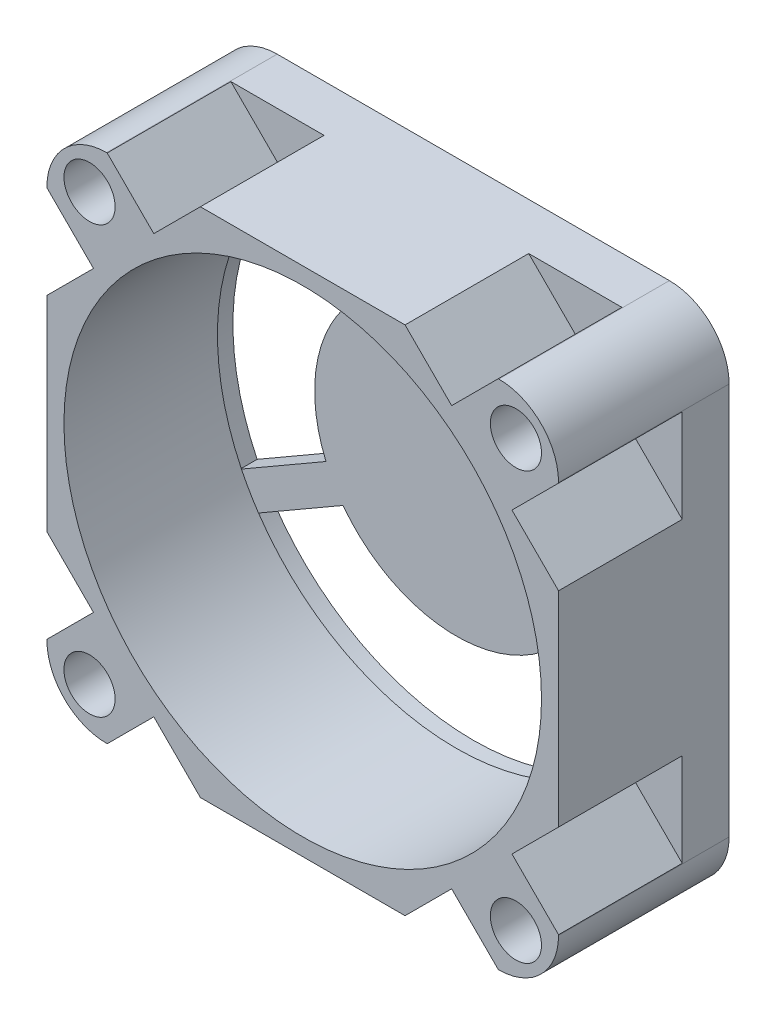
from build123d import *

# Parameters (mm, degrees)
SKETCH1_W             = 30
SKETCH1_H             = 30
BOSS_EXTRUDE1_DEPTH   = 10
SKETCH2_R             = 14
CUT_EXTRUDE1_DEPTH    = 9
CUT_EXTRUDE2_DEPTH    = 44.370496884
F_3_0MM_DOWEL_HOLE1_D = 3
CUT_EXTRUDE3_DEPTH    = 7.25
FILLET1_R             = 3.5


with BuildPart() as part:
    # Sketch1 → Boss-Extrude1 (new body)
    with BuildSketch(Plane.XY):
        with Locations((15, 15)):
            Rectangle(SKETCH1_W, SKETCH1_H)
    extrude(amount=BOSS_EXTRUDE1_DEPTH)

    # Sketch2 → Cut-Extrude1 (cut)
    with BuildSketch(Plane.XY.offset(10)):
        with Locations((15, 15)):
            Circle(SKETCH2_R)
    extrude(amount=-CUT_EXTRUDE1_DEPTH, mode=Mode.SUBTRACT)

    # Sketch3 → Cut-Extrude2 (cut, through all)
    with BuildSketch(Plane.XY.offset(1)):
        with BuildLine():
            Line((14, 23.239538822), (14, 29.05542131))
            ThreePointArc((14, 29.05542131), (2.79687945, 22.045474934), (2.327648085, 8.838314749))
            Line((2.327648085, 8.838314749), (7.364350065, 11.746255993))
            ThreePointArc((7.364350065, 11.746255993), (7.811989149, 19.15), (14, 23.239538822))
        make_face()
        with BuildLine():
            Line((16, 23.239538822), (16, 29.05542131))
            ThreePointArc((16, 29.05542131), (27.20312055, 22.045474934), (27.672351915, 8.838314749))
            Line((27.672351915, 8.838314749), (22.635649935, 11.746255993))
            ThreePointArc((22.635649935, 11.746255993), (22.188010851, 19.15), (16, 23.239538822))
        make_face()
        with BuildLine():
            Line((21.635649935, 10.014205185), (26.672351915, 7.106263941))
            ThreePointArc((26.672351915, 7.106263941), (15, 0.909050131), (3.327648085, 7.106263941))
            Line((3.327648085, 7.106263941), (8.364350065, 10.014205185))
            ThreePointArc((8.364350065, 10.014205185), (15, 6.7), (21.635649935, 10.014205185))
        make_face()
    extrude(amount=-CUT_EXTRUDE2_DEPTH, mode=Mode.SUBTRACT)

    # Ø3.0mm Dowel Hole1 (through all)
    with Locations(Plane(origin=(0, 0, 0), x_dir=(-1, 0, 0), z_dir=(0, 0, -1))):
        with Locations((-27.5, 27.5), (-2.5, 27.5), (-2.5, 2.5), (-27.5, 2.5)):
            Hole(F_3_0MM_DOWEL_HOLE1_D / 2)

    # Sketch6 → Cut-Extrude3 (cut)
    with BuildSketch(Plane.XY.offset(10)):
        Polygon((9, 30), (6.267766953, 27.267766953), (3.535533906, 30), align=None)
        Polygon((23.732233047, 27.267766953), (26.464466094, 30), (21, 30), align=None)
        Polygon((30, 26.464466094), (30, 21), (27.267766953, 23.732233047), align=None)
        Polygon((30, 9), (30, 3.535533906), (27.267766953, 6.267766953), align=None)
        Polygon((26.464466094, 0), (21, 0), (23.732233047, 2.732233047), align=None)
        Polygon((9, 0), (3.535533906, 0), (6.267766953, 2.732233047), align=None)
        Polygon((0, 3.535533906), (0, 9), (2.732233047, 6.267766953), align=None)
        Polygon((0, 21), (0, 26.464466094), (2.732233047, 23.732233047), align=None)
    extrude(amount=-CUT_EXTRUDE3_DEPTH, mode=Mode.SUBTRACT)

    # Fillet1
    fillet1_edges = [part.edges().sort_by_distance(p)[0] for p in [
        (0, 30, 5),
        (30, 30, 5),
        (30, 0, 5),
        (0, 0, 5),
    ]]
    fillet(fillet1_edges, radius=FILLET1_R)


solid = part.part
